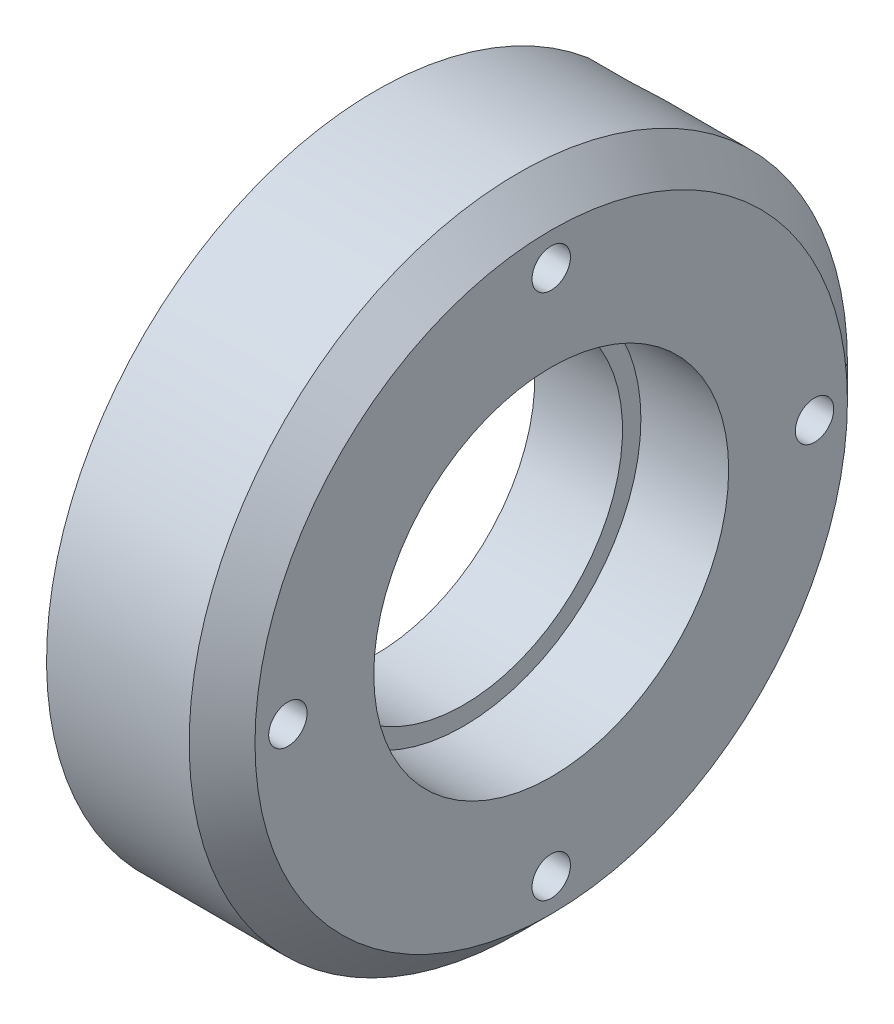
from build123d import *

# Parameters (mm, degrees)
SKETCH_1_R           = 32
SKETCH_1_R_2         = 3
EXTRUDE_1_DEPTH      = 5
SKETCH_2_R           = 30
SKETCH_2_R_2         = 16.175
EXTRUDE_2_DEPTH      = 35
SKETCH_4_R           = 17
SKETCH_4_R_2         = 14
EXTRUDE_4_DEPTH      = 5
SKETCH_8_R           = 1.5
CUT_EXTRUDE_1_DEPTH  = 10
EXTRUDE_START        = 2
SKETCH_13_R          = 3.16745637
SKETCH_13_R_2        = 3
EXTRUDE_5_DEPTH      = 2
SKETCH_14_R          = 34.626760645
CUT_EXTRUDE_5_DEPTH  = 10
SKETCH_17_R          = 1.75
CUT_EXTRUDE_7_DEPTH  = 25
SKETCH_18_R          = 32
CUT_EXTRUDE_8_DEPTH  = 17
SKETCH_19_R          = 16.3
SKETCH_19_R_2        = 14.5
EXTRUDE_6_DEPTH      = 5
EXTRUDE_START_2      = 3
SKETCH_22_R          = 16.5
SKETCH_22_R_2        = 14.5
EXTRUDE_7_DEPTH      = 3
SKETCH_23_R          = 30
SKETCH_23_R_2        = 16.5
SKETCH_23_R_3        = 1.75
EXTRUDE_8_DEPTH      = 3
CHAMFER_2_SIZE       = 3
CUT_EXTRUDE_12_DEPTH = 52.961524227


with BuildPart() as part:
    # Эскиз1 → Бобышка-Вытянуть1 (new body)
    with BuildSketch(Plane(origin=(0, 0, 0), x_dir=(0, 0, -1), z_dir=(1, 0, 0))):
        Circle(SKETCH_1_R)
        with Locations((-24, 9)):
            Circle(SKETCH_1_R_2, mode=Mode.SUBTRACT)
        with Locations((-24, -9)):
            Circle(SKETCH_1_R_2, mode=Mode.SUBTRACT)
        with BuildLine():
            ThreePointArc((6.265686517, 10.234313483), (-12, 0), (6.265686517, -10.234313483))
            ThreePointArc((6.265686517, -10.234313483), (11.121320344, -11.121320344), (10.234313483, -6.265686517))
            ThreePointArc((10.234313483, -6.265686517), (12, 0), (10.234313483, 6.265686517))
            ThreePointArc((10.234313483, 6.265686517), (11.121320344, 11.121320344), (6.265686517, 10.234313483))
        make_face(mode=Mode.SUBTRACT)
    extrude(amount=EXTRUDE_1_DEPTH)

    # Эскиз2 → Бобышка-Вытянуть2 (add)
    with BuildSketch(Plane(origin=(5, 0, 0), x_dir=(0, 0, -1), z_dir=(1, 0, 0))):
        Circle(SKETCH_2_R)
        Circle(SKETCH_2_R_2, mode=Mode.SUBTRACT)
    extrude(amount=EXTRUDE_2_DEPTH)

    # Эскиз4 → Бобышка-Вытянуть4 (add)
    with BuildSketch(Plane(origin=(5, 0, 0), x_dir=(0, 0, -1), z_dir=(1, 0, 0))):
        Circle(SKETCH_4_R)
        with Locations(Location((0, 0, 0), (0, 0, 56.681914386))):
            Circle(SKETCH_4_R_2, mode=Mode.SUBTRACT)
    extrude(amount=EXTRUDE_4_DEPTH)

    # Эскиз8 → Вырез-Вытянуть1 (cut)
    with BuildSketch(Plane(origin=(5, 0, 0), x_dir=(0, 0, -1), z_dir=(1, 0, 0))):
        with Locations((-18, -20)):
            Circle(SKETCH_8_R)
        with Locations((18, -20)):
            Circle(SKETCH_8_R)
        with Locations((18, 20)):
            Circle(SKETCH_8_R)
        with Locations((-18, 20)):
            Circle(SKETCH_8_R)
    extrude(amount=-CUT_EXTRUDE_1_DEPTH, mode=Mode.SUBTRACT)

    # Эскиз13 → Бобышка-Вытянуть5 (add)
    with BuildSketch(Plane.ZY.offset(-5).offset(EXTRUDE_START)):
        with Locations((24, 9)):
            Circle(SKETCH_13_R)
        with Locations((24, -9)):
            Circle(SKETCH_13_R_2)
        with BuildLine():
            ThreePointArc((-6.121303477, 10.321319864), (-11.239729878, 11.239729878), (-10.321319864, 6.121303477))
            ThreePointArc((-10.321319864, 6.121303477), (-8.485281374, 8.485281374), (-6.121303477, 10.321319864))
        make_face()
        with BuildLine():
            ThreePointArc((-10.321319864, -6.121303477), (-11.239729878, -11.239729878), (-6.121303477, -10.321319864))
            ThreePointArc((-6.121303477, -10.321319864), (-8.485281374, -8.485281374), (-10.321319864, -6.121303477))
        make_face()
    extrude(amount=-EXTRUDE_5_DEPTH)

    # Эскиз14 → Вырез-Вытянуть5 (cut)
    with BuildSketch(Plane(origin=(40, 0, 0), x_dir=(0, 0, -1), z_dir=(1, 0, 0))):
        Circle(SKETCH_14_R)
    extrude(amount=-CUT_EXTRUDE_5_DEPTH, mode=Mode.SUBTRACT)

    # Эскиз17 → Вырез-Вытянуть7 (cut)
    with BuildSketch(Plane(origin=(30, 0, 0), x_dir=(0, 0, -1), z_dir=(1, 0, 0))):
        with Locations((-24, 0)):
            Circle(SKETCH_17_R)
        with Locations((0, 24)):
            Circle(SKETCH_17_R)
        with Locations((24, 0)):
            Circle(SKETCH_17_R)
        with Locations((0, -24)):
            Circle(SKETCH_17_R)
    extrude(amount=-CUT_EXTRUDE_7_DEPTH, mode=Mode.SUBTRACT)

    # Эскиз18 → Вырез-Вытянуть8 (cut)
    with BuildSketch(Plane.ZY):
        Circle(SKETCH_18_R)
    extrude(amount=-CUT_EXTRUDE_8_DEPTH, mode=Mode.SUBTRACT)

    # Эскиз19 → Бобышка-Вытянуть6 (add)
    with BuildSketch(Plane.ZY.offset(-17)):
        Circle(SKETCH_19_R)
        Circle(SKETCH_19_R_2, mode=Mode.SUBTRACT)
    extrude(amount=-EXTRUDE_6_DEPTH)

    # Эскиз22 → Бобышка-Вытянуть7 (add)
    with BuildSketch(Plane.ZY.offset(-17).offset(EXTRUDE_START_2)):
        Circle(SKETCH_22_R)
        Circle(SKETCH_22_R_2, mode=Mode.SUBTRACT)
    extrude(amount=-EXTRUDE_7_DEPTH)

    # Эскиз23 → Бобышка-Вытянуть8 (add)
    with BuildSketch(Plane.ZY.offset(-17)):
        Circle(SKETCH_23_R)
        Circle(SKETCH_23_R_2, mode=Mode.SUBTRACT)
        with Locations(Location((-24, 0, 0), (0, 0, 180))):
            Circle(SKETCH_23_R_3, mode=Mode.SUBTRACT)
        with Locations(Location((0, 24, 0), (0, 0, 180))):
            Circle(SKETCH_23_R_3, mode=Mode.SUBTRACT)
        with Locations(Location((24, 0, 0), (0, 0, 180))):
            Circle(SKETCH_23_R_3, mode=Mode.SUBTRACT)
        with Locations(Location((0, -24, 0), (0, 0, 180))):
            Circle(SKETCH_23_R_3, mode=Mode.SUBTRACT)
    extrude(amount=EXTRUDE_8_DEPTH)

    # Фаска2
    chamfer_2_edges = [part.edges().sort_by_distance(p)[0] for p in [
        (30, 0, 30),
    ]]
    chamfer(chamfer_2_edges, length=CHAMFER_2_SIZE)

    # Эскиз26 → Вырез-Вытянуть12 (cut, through all)
    with BuildSketch(Plane(origin=(0, 0, 0), x_dir=(1, 0, 0), z_dir=(0, -0.7071067811865437, 0.7071067811865513))):
        with BuildLine():
            Line((12, 2.5), (17, 2.5))
            ThreePointArc((17, 2.5), (19.5, 0), (17, -2.5))
            Line((17, -2.5), (12, -2.5))
            Line((12, -2.5), (12, 2.5))
        make_face()
    extrude(amount=-CUT_EXTRUDE_12_DEPTH, mode=Mode.SUBTRACT)


solid = part.part
